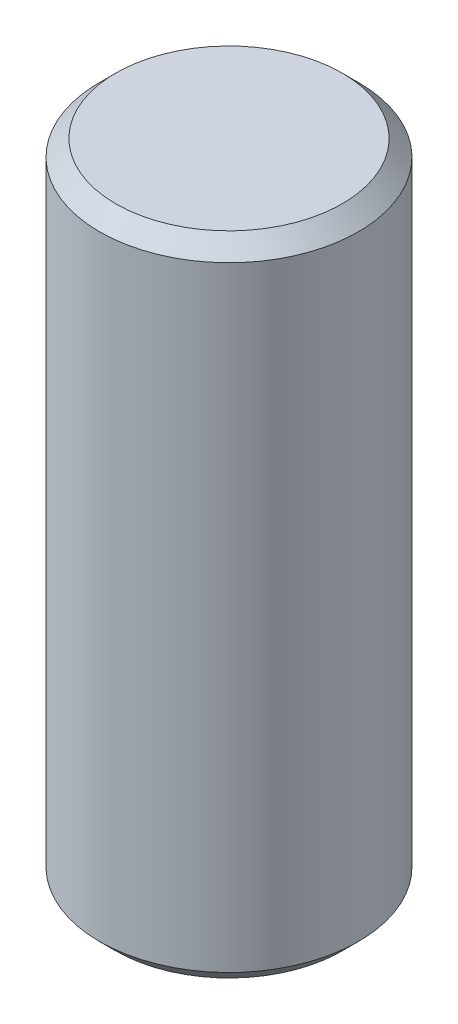
from build123d import *

# Parameters (mm, degrees)
SKETCH_1_R      = 8
EXTRUDE_1_DEPTH = 40
CHAMFER_1_SIZE  = 1


with BuildPart() as part:
    # 草图1 → 凸台-拉伸1 (new body)
    with BuildSketch(Plane(origin=(0, 0, 0), x_dir=(1, 0, 0), z_dir=(0, 1, 0))):
        with Locations(Location((0, 0, 0), (0, 0, 270))):
            Circle(SKETCH_1_R)
    extrude(amount=EXTRUDE_1_DEPTH)

    # 倒角1
    chamfer_1_edges = [part.edges().sort_by_distance(p)[0] for p in [
        (0, 0, -8),
        (0, 40, -8),
    ]]
    chamfer(chamfer_1_edges, length=CHAMFER_1_SIZE)


solid = part.part
